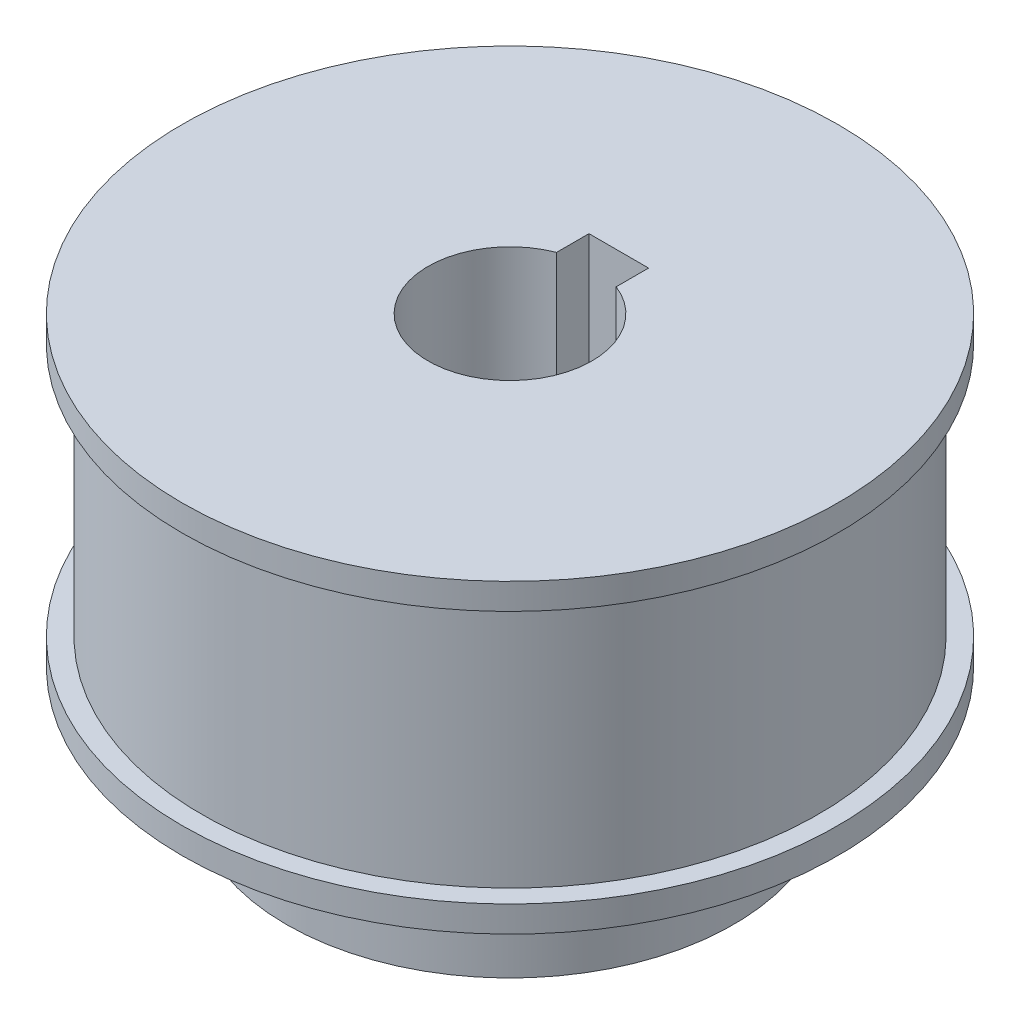
from build123d import *

# Parameters (mm, degrees)
SKETCH2_R          = 5.5
CUT_EXTRUDE1_DEPTH = 33
CUT_EXTRUDE2_DEPTH = 33
SKETCH4_R          = 1.2
CUT_EXTRUDE3_DEPTH = 80


with BuildPart() as part:
    # Sketch1 → Revolve1 (revolve)
    with BuildSketch(Plane.XY, mode=Mode.PRIVATE) as revolve1_sk:
        Polygon((4, 0), (15, 0), (15, 7.5), (22, 7.5), (22, 9.25), (20.69, 9.25), (20.69, 26.25), (22, 26.25), (22, 28), (4, 28), align=None)
    revolve(revolve1_sk.sketch.rotate(Axis((0, 0, 0), (0, 1, 0)), 90), axis=Axis((0, 0, 0), (0, 1, 0)))

    # Sketch2 → Cut-Extrude1 (cut)
    with BuildSketch(Plane(origin=(0, 28, 0), x_dir=(1, 0, 0), z_dir=(0, 1, 0))):
        with Locations(Location((0, 0, 0), (0, 0, 270))):
            Circle(SKETCH2_R)
    extrude(amount=-CUT_EXTRUDE1_DEPTH, mode=Mode.SUBTRACT)

    # Sketch3 → Cut-Extrude2 (cut)
    with BuildSketch(Plane(origin=(0, 28, 0), x_dir=(1, 0, 0), z_dir=(0, 1, 0))):
        with BuildLine():
            Line((-2, 7.3), (-2, 5.123475383))
            ThreePointArc((-2, 5.123475383), (0, 5.5), (2, 5.123475383))
            Line((2, 5.123475383), (2, 7.3))
            Line((2, 7.3), (-2, 7.3))
        make_face()
    extrude(amount=-CUT_EXTRUDE2_DEPTH, mode=Mode.SUBTRACT)

    # Sketch4 → Cut-Extrude3 (cut)
    with BuildSketch(Plane.XY.offset(-7.3)):
        with Locations((0, 3.75)):
            Circle(SKETCH4_R)
    extrude(amount=-CUT_EXTRUDE3_DEPTH, mode=Mode.SUBTRACT)


solid = part.part
